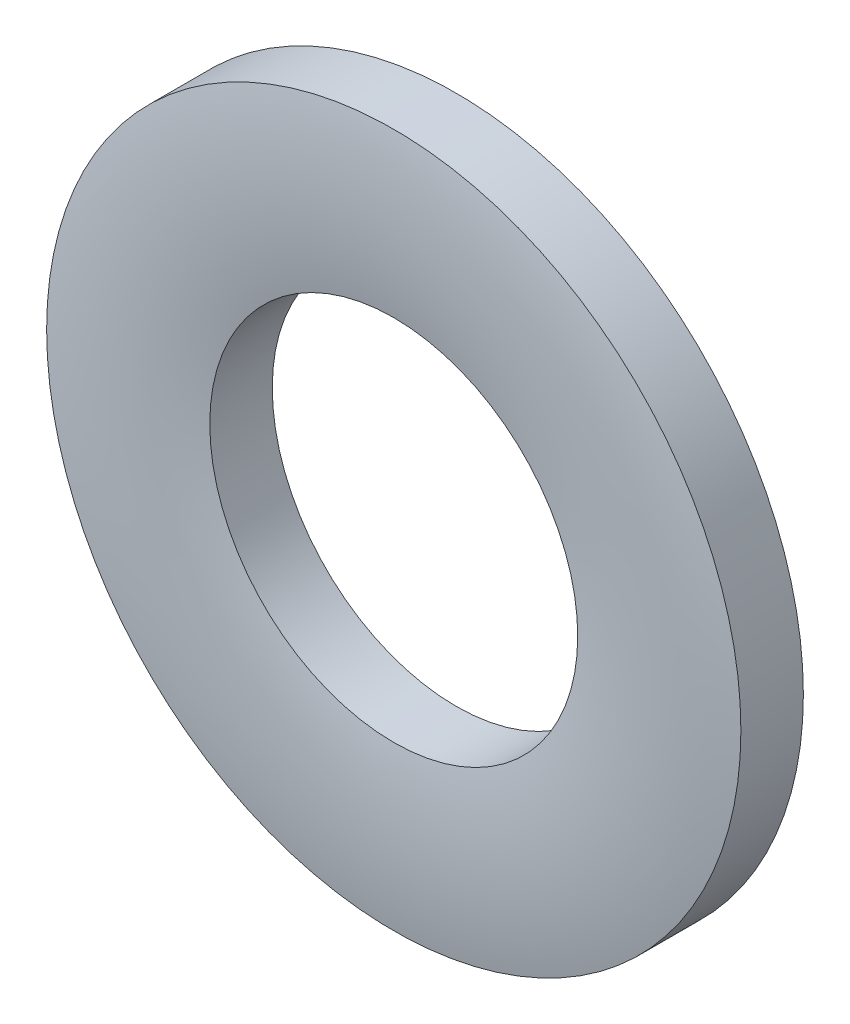
from build123d import *


with BuildPart() as part:
    # Sketch3 → Revolve1 (revolve)
    with BuildSketch(Plane(origin=(0, 0, 0), x_dir=(0, 0, -1), z_dir=(1, 0, 0)), mode=Mode.PRIVATE) as revolve1_sk:
        with BuildLine():
            Line((0.5, 5), (-0.4, 5))
            ThreePointArc((-0.4, 5), (-0.5, 3.825), (-0.4, 2.65))
            Line((-0.4, 2.65), (0.5, 2.65))
            Line((0.5, 2.65), (0.5, 5))
        make_face()
    revolve(revolve1_sk.sketch.rotate(Axis((0, 0, 0.5), (0, 0, -1)), 90), axis=Axis((0, 0, 0.5), (0, 0, -1)))


solid = part.part
